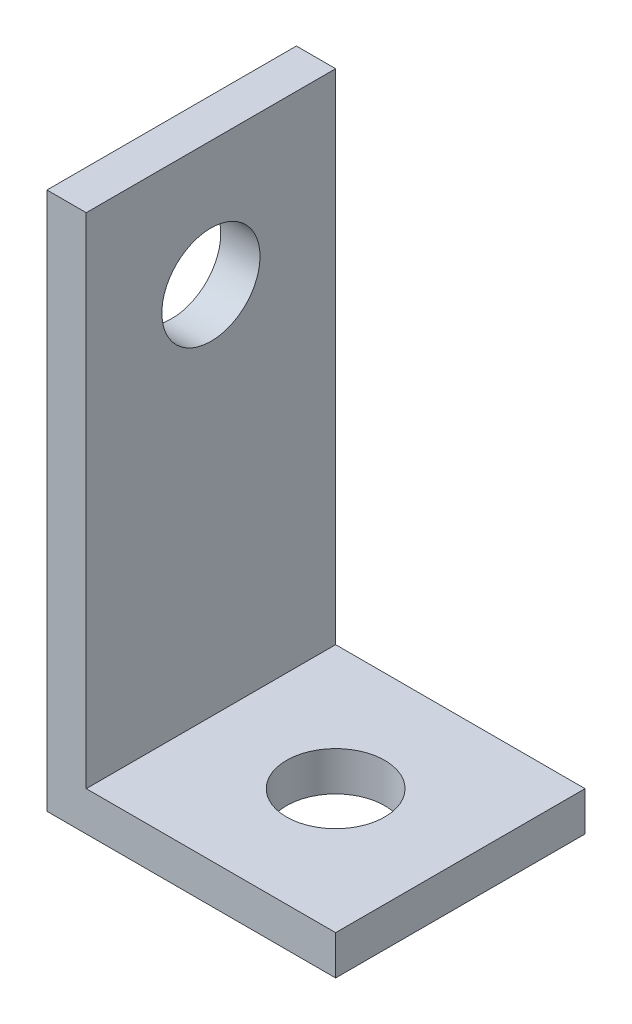
from build123d import *

# Parameters (mm, degrees)
SKETCH1_W             = 14.7
SKETCH1_H             = 2
SKETCH1_W_2           = 2
SKETCH1_H_2           = 25.4
BOSS_EXTRUDE1_DEPTH   = 12.7
F_5_0MM_DOWEL_HOLE1_D = 5
F_5_0MM_DOWEL_HOLE2_D = 5


with BuildPart() as part:
    # Sketch1 → Boss-Extrude1 (new body)
    with BuildSketch(Plane.XY):
        with Locations((7.35, 1)):
            Rectangle(SKETCH1_W, SKETCH1_H)
        with Locations((1, 14.7)):
            Rectangle(SKETCH1_W_2, SKETCH1_H_2)
    extrude(amount=BOSS_EXTRUDE1_DEPTH)

    # Ø5.0mm Dowel Hole1 (through all)
    with Locations(Plane(origin=(2, 0, 0), x_dir=(0, 0, -1), z_dir=(1, 0, 0))):
        with Locations((-6.35, 21.05)):
            Hole(F_5_0MM_DOWEL_HOLE1_D / 2)

    # Ø5.0mm Dowel Hole2 (through all)
    with Locations(Plane(origin=(0, 2, 0), x_dir=(1, 0, 0), z_dir=(0, 1, 0))):
        with Locations((8.35, -6.35)):
            Hole(F_5_0MM_DOWEL_HOLE2_D / 2)


solid = part.part
